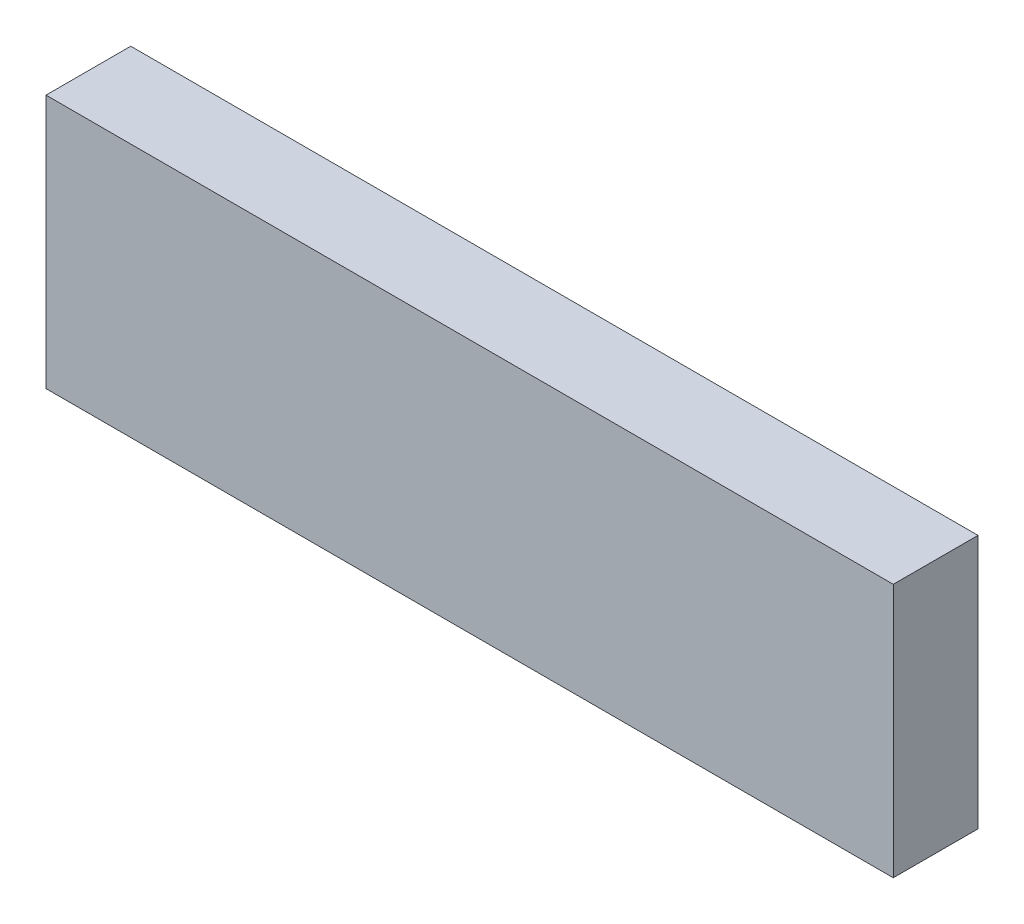
from build123d import *

# Parameters (mm, degrees)
SKETCH1_W           = 500
SKETCH1_H           = 150
BOSS_EXTRUDE1_DEPTH = 25


with BuildPart() as part:
    # Sketch1 → Boss-Extrude1 (new, symmetric)
    with BuildSketch(Plane.XY):
        Rectangle(SKETCH1_W, SKETCH1_H)
    extrude(amount=BOSS_EXTRUDE1_DEPTH, both=True)


solid = part.part
